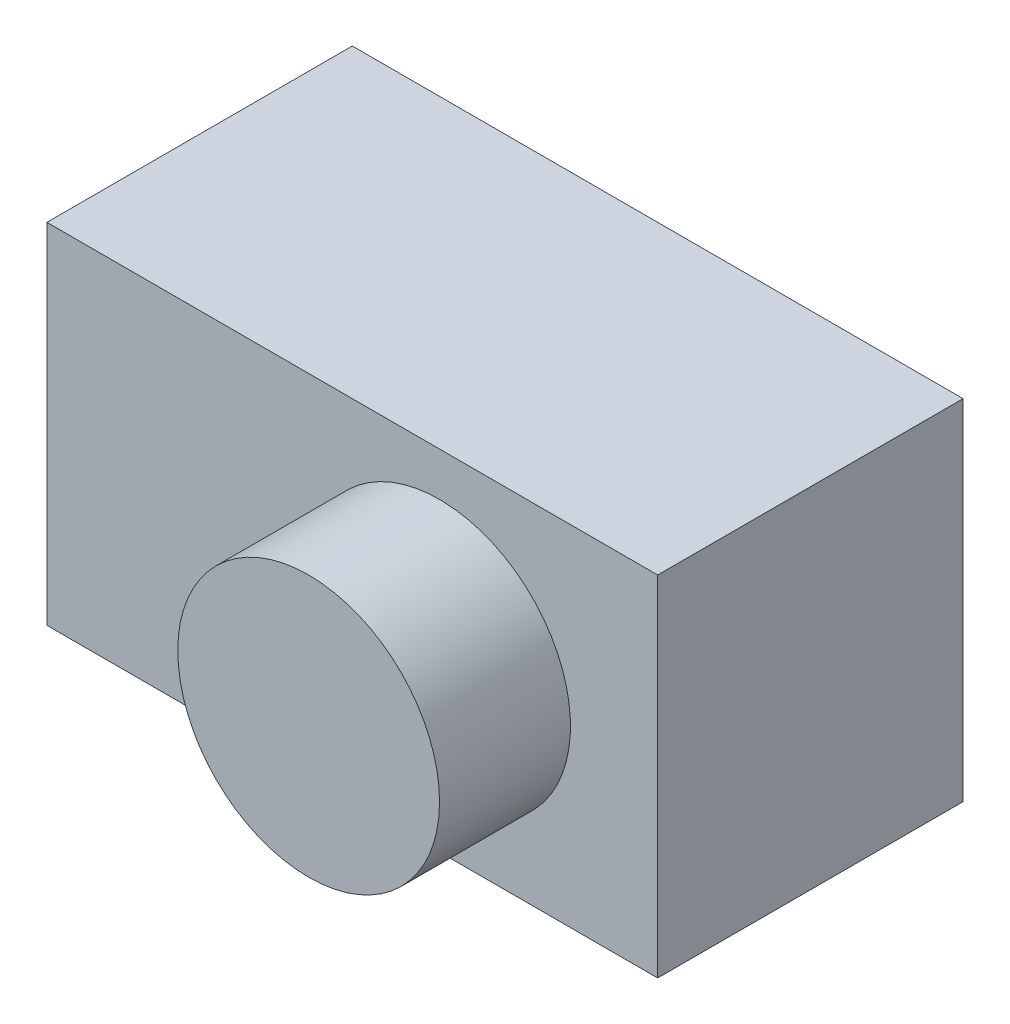
from build123d import *

# Parameters (mm, degrees)
SKETCH_1_W      = 140
SKETCH_1_H      = 80
EXTRUDE_1_DEPTH = 70
SKETCH_2_R      = 30
EXTRUDE_2_DEPTH = 30


with BuildPart() as part:
    # 草图1 → 凸台-拉伸1 (new body)
    with BuildSketch(Plane.XY):
        with Locations((70, 40)):
            Rectangle(SKETCH_1_W, SKETCH_1_H)
    extrude(amount=EXTRUDE_1_DEPTH)

    # 草图2 → 凸台-拉伸2 (add)
    with BuildSketch(Plane.XY.offset(70)):
        with Locations(Location((90, 40, 0), (0, 0, 180))):
            Circle(SKETCH_2_R)
    extrude(amount=EXTRUDE_2_DEPTH)


solid = part.part
